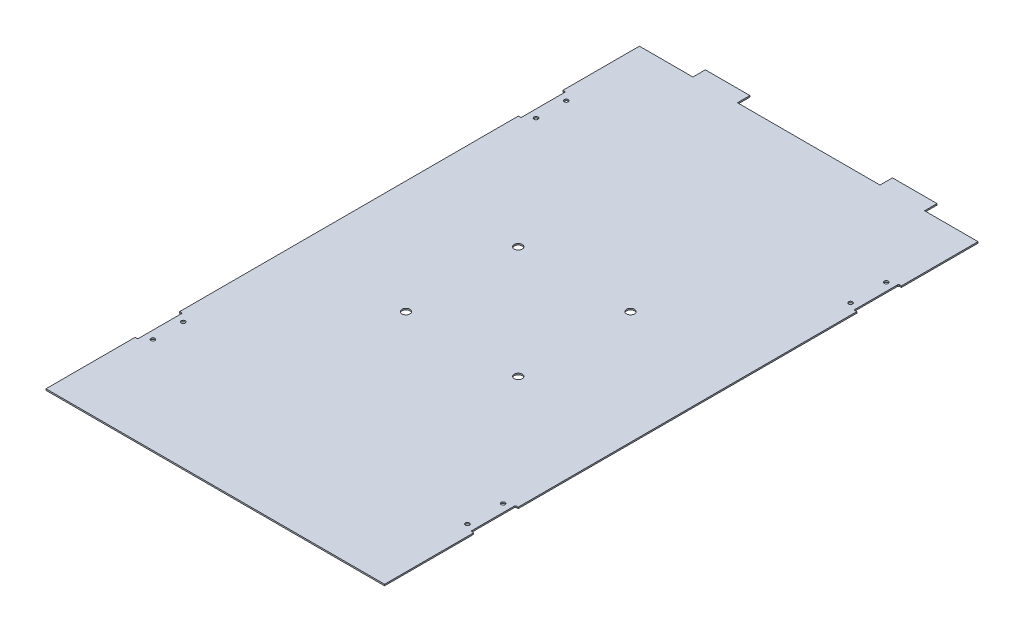
from build123d import *

# Parameters (mm, degrees)
PANEL_DEPTH                 = 0.79
SKETCH3_R                   = 1.125
OUTER_HINGE_MOUNT_DEPTH     = 0.79
SKETCH4_R                   = 2.25
MOUNTING_PLATE_HOLES_DEPTH  = 10
SKETCH7_R                   = 1.125
NEW_INNER_HINGE_MOUNT_DEPTH = 10


with BuildPart() as part:
    # Sketch1 → Panel (new body)
    with BuildSketch(Plane(origin=(0, 0, 0), x_dir=(1, 0, 0), z_dir=(0, 1, 0))):
        Polygon((65.326251897, 149.069802731), (95.326251897, 149.069802731), (95.326251897, -183.930197269), (-94.673748103, -183.930197269), (-94.673748103, 149.069802731), (-64.673748103, 149.069802731), (-64.673748103, 156.069802731), (-39.673748103, 156.069802731), (-39.673748103, 149.069802731), (40.326251897, 149.069802731), (40.326251897, 156.069802731), (65.326251897, 156.069802731), align=None)
    extrude(amount=PANEL_DEPTH)

    # Sketch3 → Outer Hinge Mount (cut)
    with BuildSketch(Plane(origin=(0, 0.79, 0), x_dir=(1, 0, 0), z_dir=(0, 1, 0))):
        with Locations(Location((-88.673748103, -112.930197269, 0), (0, 0, 270))):
            Circle(SKETCH3_R)
        with Locations(Location((-88.673748103, -129.930197269, 0), (0, 0, 270))):
            Circle(SKETCH3_R)
        with BuildLine():
            Line((-94.673748103, -108.930197269), (-93.673748103, -108.930197269))
            ThreePointArc((-93.673748103, -108.930197269), (-93.320194713, -109.076643878), (-93.173748103, -109.430197269))
            Line((-93.173748103, -109.430197269), (-93.173748103, -133.430197269))
            ThreePointArc((-93.173748103, -133.430197269), (-93.320194713, -133.783750659), (-93.673748103, -133.930197269))
            Line((-93.673748103, -133.930197269), (-94.673748103, -133.930197269))
            Line((-94.673748103, -133.930197269), (-94.673748103, -108.930197269))
        make_face()
    outer_hinge_mount = extrude(amount=-OUTER_HINGE_MOUNT_DEPTH, mode=Mode.SUBTRACT)

    # Mirror1: Outer Hinge Mount across plane
    add(outer_hinge_mount.mirror(Plane.XY.offset(13.930197269)), mode=Mode.SUBTRACT)

    # Sketch4 → Mounting Plate Holes (cut)
    with BuildSketch(Plane(origin=(0, 0.79, 0), x_dir=(1, 0, 0), z_dir=(0, 1, 0))):
        with Locations(Location((-31.176486576, 17.572541204, 0), (0, 0, 270))):
            Circle(SKETCH4_R)
        with Locations(Location((31.82899037, 17.572541204, 0), (0, 0, 270))):
            Circle(SKETCH4_R)
        with Locations(Location((31.82899037, -45.432935741, 0), (0, 0, 270))):
            Circle(SKETCH4_R)
        with Locations(Location((-31.176486576, -45.432935741, 0), (0, 0, 270))):
            Circle(SKETCH4_R)
    extrude(amount=-MOUNTING_PLATE_HOLES_DEPTH, mode=Mode.SUBTRACT)

    # Sketch7 → New Inner Hinge Mount (cut)
    with BuildSketch(Plane(origin=(0, 0.79, 0), x_dir=(1, 0, 0), z_dir=(0, 1, 0))):
        with Locations(Location((89.326251897, -111.430197269, 0), (0, 0, 270))):
            Circle(SKETCH7_R)
        with Locations(Location((89.326251897, -131.430197269, 0), (0, 0, 270))):
            Circle(SKETCH7_R)
        with BuildLine():
            Line((95.326251897, -108.930197269), (94.246251897, -108.930197269))
            ThreePointArc((94.246251897, -108.930197269), (93.892698506, -109.076643878), (93.746251897, -109.430197269))
            Line((93.746251897, -109.430197269), (93.746251897, -133.296285761))
            ThreePointArc((93.746251897, -133.296285761), (93.931920279, -133.744528887), (94.380163405, -133.930197269))
            Line((94.380163405, -133.930197269), (95.326251897, -133.930197269))
            Line((95.326251897, -133.930197269), (95.326251897, -108.930197269))
        make_face()
    new_inner_hinge_mount = extrude(amount=-NEW_INNER_HINGE_MOUNT_DEPTH, mode=Mode.SUBTRACT)

    # Mirror3: New Inner Hinge Mount across plane
    add(new_inner_hinge_mount.mirror(Plane.XY.offset(13.930197269)), mode=Mode.SUBTRACT)


solid = part.part
